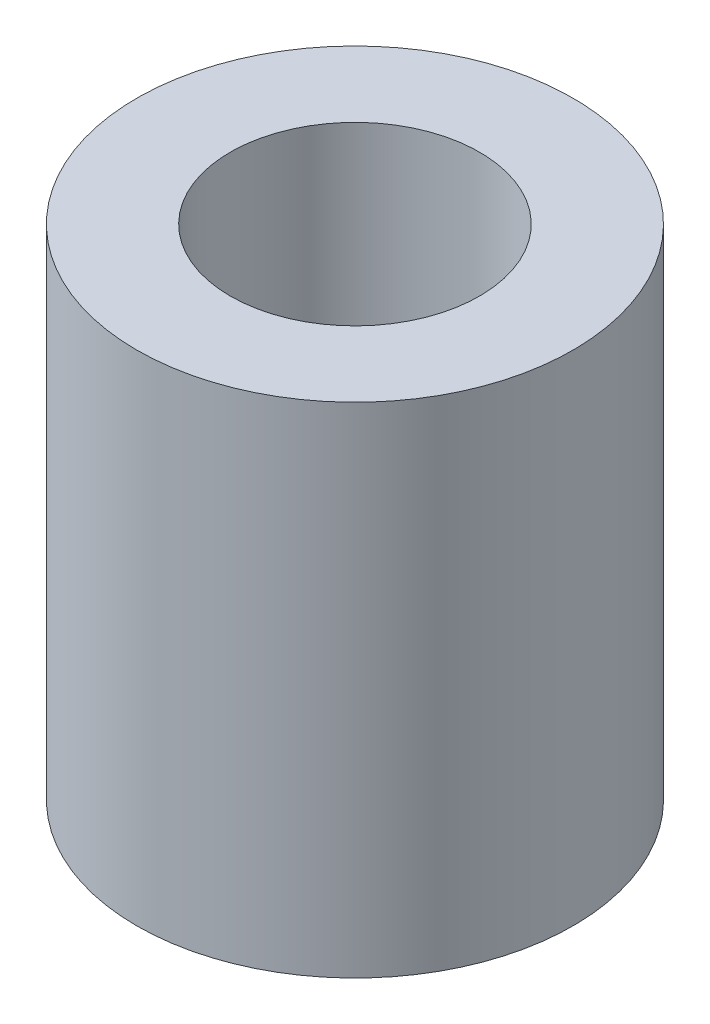
from build123d import *

# Parameters (mm, degrees)
SKETCH1_R           = 2.778125
BOSS_EXTRUDE1_DEPTH = 6.35
SKETCH2_R           = 1.5875
CUT_EXTRUDE1_DEPTH  = 6.35


with BuildPart() as part:
    # Sketch1 → Boss-Extrude1 (new body)
    with BuildSketch(Plane(origin=(0, 0, 0), x_dir=(1, 0, 0), z_dir=(0, 1, 0))):
        with Locations(Location((0, 0, 0), (0, 0, 270))):
            Circle(SKETCH1_R)
    extrude(amount=BOSS_EXTRUDE1_DEPTH)

    # Sketch2 → Cut-Extrude1 (cut)
    with BuildSketch(Plane(origin=(0, 6.35, 0), x_dir=(1, 0, 0), z_dir=(0, 1, 0))):
        with Locations(Location((0, 0, 0), (0, 0, 270))):
            Circle(SKETCH2_R)
    extrude(amount=-CUT_EXTRUDE1_DEPTH, mode=Mode.SUBTRACT)


solid = part.part
